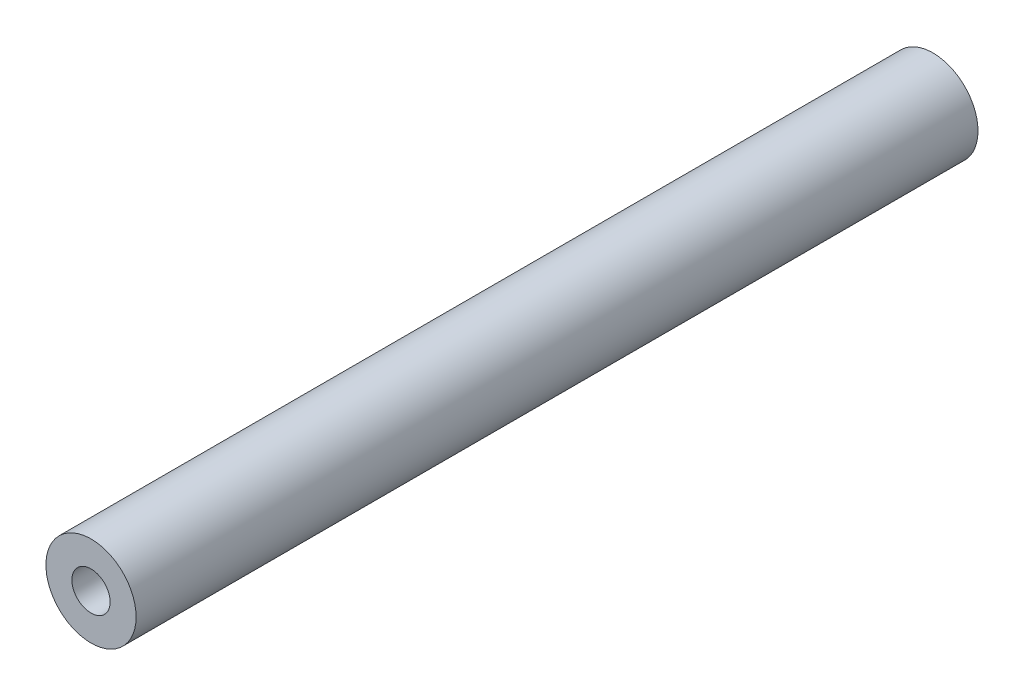
from build123d import *

# Parameters (mm, degrees)
SKETCH1_R                            = 4.7625
BOSS_EXTRUDE1_DEPTH                  = 44.45
F_10_32_TAPPED_HOLE1_D               = 4.0386
F_10_32_TAPPED_HOLE1_DEPTH           = 11.938
F_10_32_TAPPED_HOLE1_TIP             = 1.213317848
F_10_32_TAPPED_HOLE1_ON_FACE_2_D     = 4.0386
F_10_32_TAPPED_HOLE1_ON_FACE_2_DEPTH = 11.938
F_10_32_TAPPED_HOLE1_ON_FACE_2_TIP   = 1.213317848


with BuildPart() as part:
    # Sketch1 → Boss-Extrude1 (new, symmetric)
    with BuildSketch(Plane.XY):
        Circle(SKETCH1_R)
    extrude(amount=BOSS_EXTRUDE1_DEPTH, both=True)

    # #10-32 Tapped Hole1
    with Locations(Plane.XY.offset(44.45)):
        with Locations((0, 0)):
            Hole(F_10_32_TAPPED_HOLE1_D / 2, depth=F_10_32_TAPPED_HOLE1_DEPTH)
            with Locations((0, 0, -(F_10_32_TAPPED_HOLE1_DEPTH + F_10_32_TAPPED_HOLE1_TIP / 2))):  # 118° drill point
                Cone(0, F_10_32_TAPPED_HOLE1_D / 2, F_10_32_TAPPED_HOLE1_TIP, mode=Mode.SUBTRACT)

    # #10-32 Tapped Hole1 on face 2
    with Locations(Plane(origin=(0, 0, -44.45), x_dir=(-1, 0, 0), z_dir=(0, 0, -1))):
        with Locations((0, 0)):
            Hole(F_10_32_TAPPED_HOLE1_ON_FACE_2_D / 2, depth=F_10_32_TAPPED_HOLE1_ON_FACE_2_DEPTH)
            with Locations((0, 0, -(F_10_32_TAPPED_HOLE1_ON_FACE_2_DEPTH + F_10_32_TAPPED_HOLE1_ON_FACE_2_TIP / 2))):  # 118° drill point
                Cone(0, F_10_32_TAPPED_HOLE1_ON_FACE_2_D / 2, F_10_32_TAPPED_HOLE1_ON_FACE_2_TIP, mode=Mode.SUBTRACT)


solid = part.part
